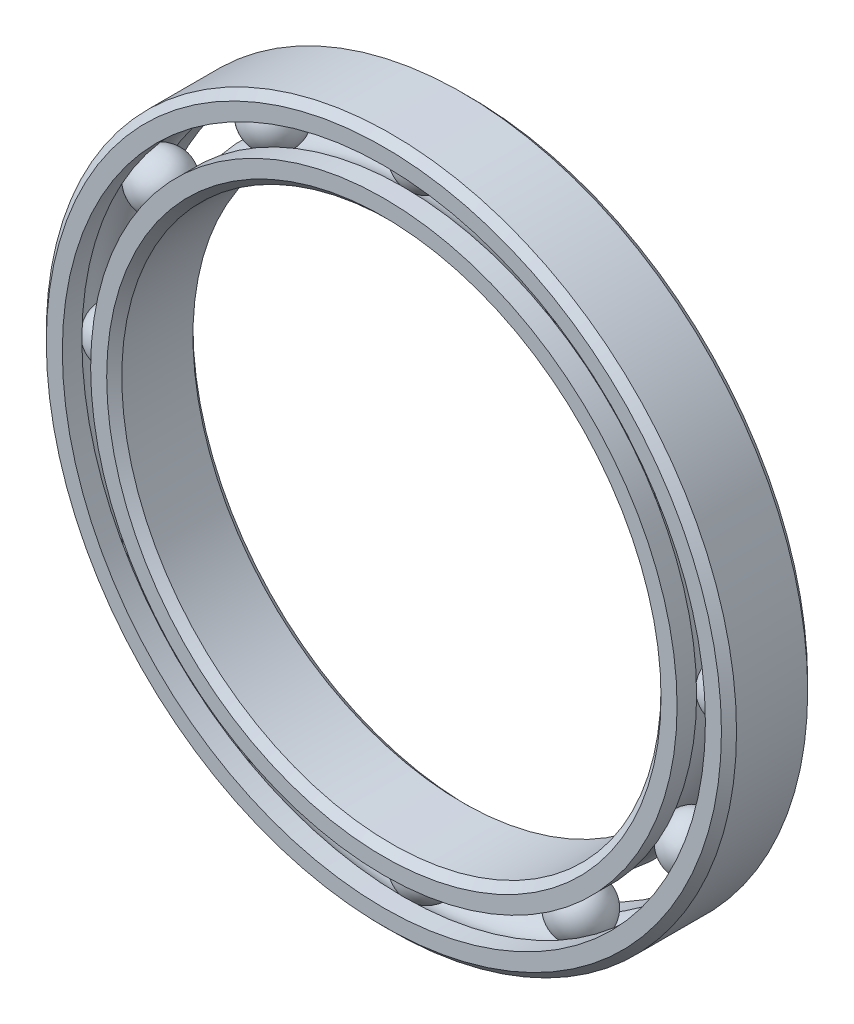
from build123d import *

# Parameters (mm, degrees)
CIRPATTERN1_COUNT = 12


with BuildPart() as part:
    # Sketch1 → Revolve1 (revolve)
    with BuildSketch(Plane(origin=(0, 0, 0), x_dir=(0, 0, -1), z_dir=(1, 0, 0))):
        with BuildLine():
            Line((1.65, 16), (-1.65, 16))
            Line((-1.65, 16), (-2, 15.65))
            Line((-2, 15.65), (-2, 14.906302655))
            Line((-2, 14.906302655), (-1.094040627, 14.906302655))
            ThreePointArc((-1.094040627, 14.906302655), (0, 15.525797033), (1.094040627, 14.906302655))
            Line((1.094040627, 14.906302655), (2, 14.906302655))
            Line((2, 14.906302655), (2, 15.65))
            Line((2, 15.65), (1.65, 16))
        make_face()
    revolve(axis=Axis((0, 0, 2), (0, 0, -1)))


with BuildPart() as body_2:
    # Sketch3 → Revolve3 (revolve)
    with BuildSketch(Plane(origin=(0, 0, 0), x_dir=(0, 0, -1), z_dir=(1, 0, 0))):
        with BuildLine():
            Line((-2, 13.593697345), (-1.094040627, 13.593697345))
            ThreePointArc((-1.094040627, 13.593697345), (0, 12.974202967), (1.094040627, 13.593697345))
            Line((1.094040627, 13.593697345), (2, 13.593697345))
            Line((2, 13.593697345), (2, 12.85))
            Line((2, 12.85), (1.65, 12.5))
            Line((1.65, 12.5), (-1.65, 12.5))
            Line((-1.65, 12.5), (-2, 12.85))
            Line((-2, 12.85), (-2, 13.593697345))
        make_face()
    revolve(axis=Axis((0, 0, 2), (0, 0, -1)))


with BuildPart() as body_3:
    # Sketch4 → Revolve4 (revolve)
    with BuildSketch(Plane(origin=(0, 0, 0), x_dir=(0, 0, -1), z_dir=(1, 0, 0))):
        with BuildLine():
            Line((-1.275797033, 14.25), (1.275797033, 14.25))
            ThreePointArc((1.275797033, 14.25), (0, 15.525797033), (-1.275797033, 14.25))
        make_face()
    revolve(axis=Axis((0, 14.25, 1.275797033), (0, 0, -1)))


with BuildPart() as cirpattern1_1:
    # CirPattern1: pattern copy
    add(body_3.part.rotate(Axis((0, 0, -2), (0, 0, 1)), 1 * 360 / CIRPATTERN1_COUNT))


with BuildPart() as cirpattern1_2:
    # CirPattern1: pattern copy
    add(body_3.part.rotate(Axis((0, 0, -2), (0, 0, 1)), 2 * 360 / CIRPATTERN1_COUNT))


with BuildPart() as cirpattern1_3:
    # CirPattern1: pattern copy
    add(body_3.part.rotate(Axis((0, 0, -2), (0, 0, 1)), 3 * 360 / CIRPATTERN1_COUNT))


with BuildPart() as cirpattern1_4:
    # CirPattern1: pattern copy
    add(body_3.part.rotate(Axis((0, 0, -2), (0, 0, 1)), 4 * 360 / CIRPATTERN1_COUNT))


with BuildPart() as cirpattern1_5:
    # CirPattern1: pattern copy
    add(body_3.part.rotate(Axis((0, 0, -2), (0, 0, 1)), 5 * 360 / CIRPATTERN1_COUNT))


with BuildPart() as cirpattern1_6:
    # CirPattern1: pattern copy
    add(body_3.part.rotate(Axis((0, 0, -2), (0, 0, 1)), 6 * 360 / CIRPATTERN1_COUNT))


with BuildPart() as cirpattern1_7:
    # CirPattern1: pattern copy
    add(body_3.part.rotate(Axis((0, 0, -2), (0, 0, 1)), 7 * 360 / CIRPATTERN1_COUNT))


with BuildPart() as cirpattern1_8:
    # CirPattern1: pattern copy
    add(body_3.part.rotate(Axis((0, 0, -2), (0, 0, 1)), 8 * 360 / CIRPATTERN1_COUNT))


with BuildPart() as cirpattern1_9:
    # CirPattern1: pattern copy
    add(body_3.part.rotate(Axis((0, 0, -2), (0, 0, 1)), 9 * 360 / CIRPATTERN1_COUNT))


with BuildPart() as cirpattern1_10:
    # CirPattern1: pattern copy
    add(body_3.part.rotate(Axis((0, 0, -2), (0, 0, 1)), 10 * 360 / CIRPATTERN1_COUNT))


with BuildPart() as cirpattern1_11:
    # CirPattern1: pattern copy
    add(body_3.part.rotate(Axis((0, 0, -2), (0, 0, 1)), 11 * 360 / CIRPATTERN1_COUNT))


solid = Compound([part.part, body_2.part, body_3.part, cirpattern1_1.part, cirpattern1_2.part, cirpattern1_3.part, cirpattern1_4.part, cirpattern1_5.part, cirpattern1_6.part, cirpattern1_7.part, cirpattern1_8.part, cirpattern1_9.part, cirpattern1_10.part, cirpattern1_11.part])
